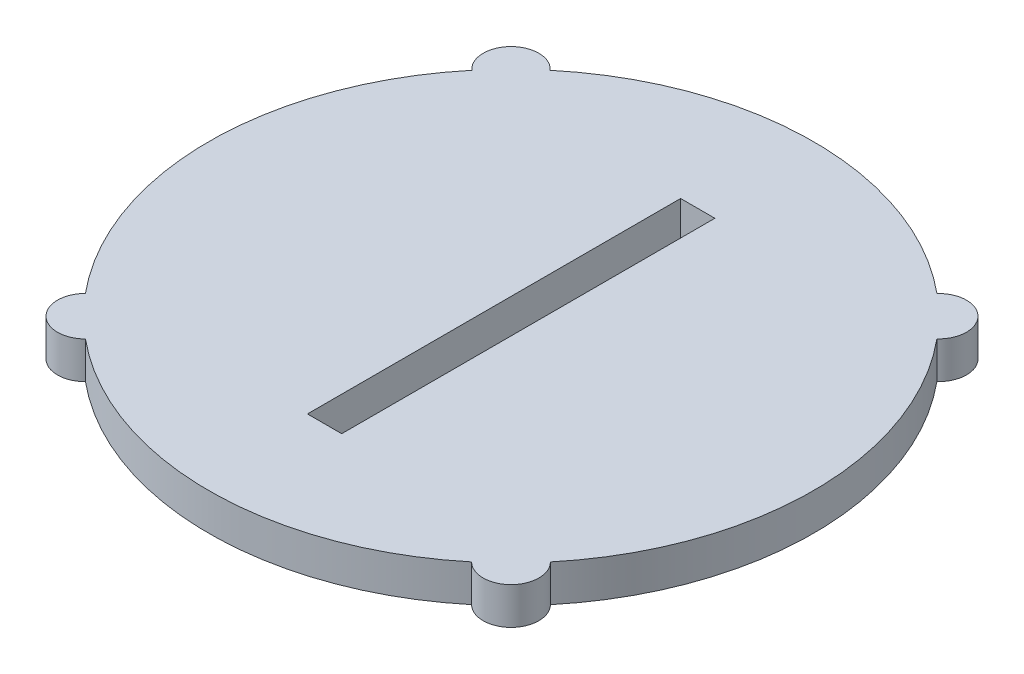
from build123d import *

# Parameters (mm, degrees)
BOSS_EXTRUDE1_DEPTH = 4


with BuildPart() as part:
    # Sketch1 → Boss-Extrude1 (new body)
    with BuildSketch(Plane(origin=(0, 0, 0), x_dir=(1, 0, 0), z_dir=(0, 1, 0))):
        with BuildLine():
            ThreePointArc((-71.868882923, 41.744528782), (-71.873310505, 41.73919705), (-71.877736955, 41.733864379))
            ThreePointArc((-71.877736955, 41.733864379), (-79.402730452, 20.871324191), (-71.862759828, 0.01419224))
            ThreePointArc((-71.862759828, 0.01419224), (-71.861231345, -4.243487526), (-67.603551579, -4.241959043))
            ThreePointArc((-67.603551579, -4.241959043), (-46.752732556, -11.766954644), (-25.901913533, -4.241959043))
            ThreePointArc((-25.901913533, -4.241959043), (-21.644233766, -4.243487526), (-21.642705283, 0.01419224))
            ThreePointArc((-21.642705283, 0.01419224), (-16.577915273, 8.412965085), (-14.235919977, 17.936963257))
            ThreePointArc((-14.235919977, 17.936963257), (-15.574380313, 30.574941531), (-21.636582188, 41.744528782))
            ThreePointArc((-21.636582188, 41.744528782), (-21.535327773, 46.082350824), (-25.873221397, 45.984210943))
            ThreePointArc((-25.873221397, 45.984210943), (-34.22276847, 51.033045356), (-43.691357182, 53.389206016))
            ThreePointArc((-43.691357182, 53.389206016), (-56.400529129, 52.075071922), (-67.632243714, 45.984210943))
            ThreePointArc((-67.632243714, 45.984210943), (-71.970137338, 46.082350824), (-71.868882923, 41.744528782))
        make_face()
        Polygon((-48.602732556, 0.733045356), (-48.602732556, 20.883045356), (-48.602732556, 41.033045356), (-44.902732556, 41.033045356), (-44.902732556, 20.883045356), (-44.902732556, 0.733045356), align=None, mode=Mode.SUBTRACT)
    extrude(amount=BOSS_EXTRUDE1_DEPTH)


solid = part.part
